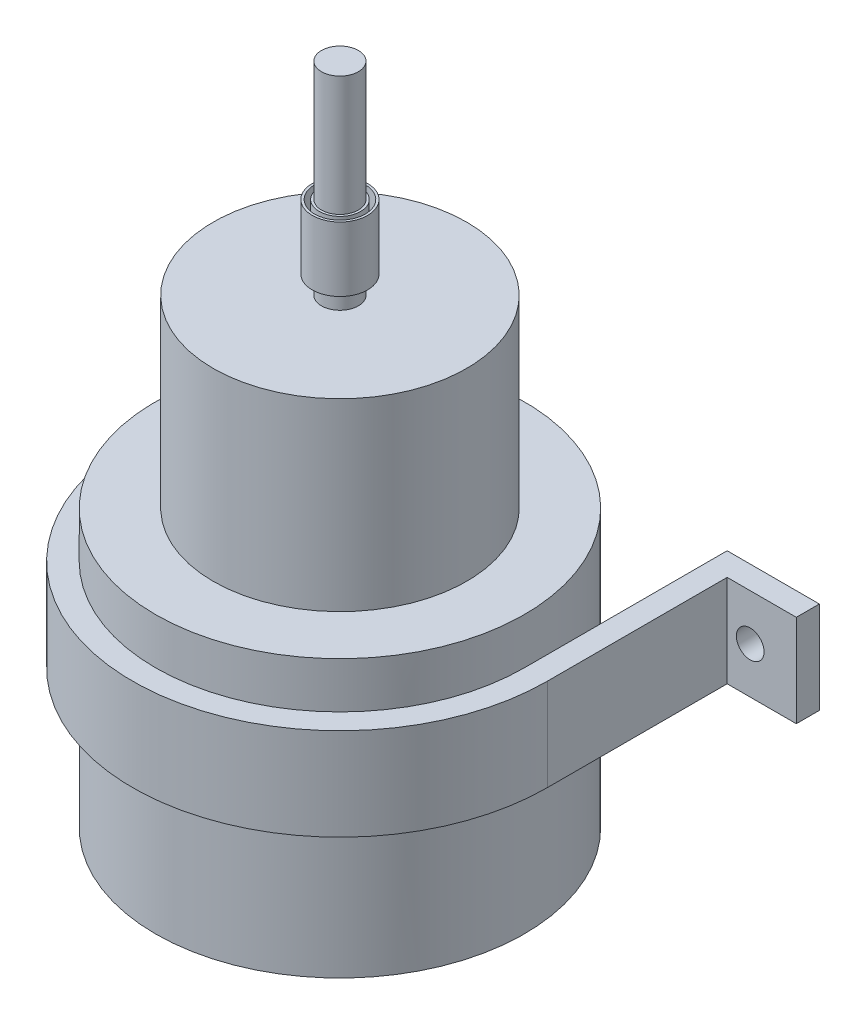
from build123d import *

# Parameters (mm, degrees)
SKETCH1_R           = 20
BOSS_EXTRUDE1_DEPTH = 30
SKETCH2_R           = 13.75
BOSS_EXTRUDE2_DEPTH = 20
SKETCH3_R           = 2
BOSS_EXTRUDE3_DEPTH = 22
EXTRUDE_THIN2_START = -10
EXTRUDE_THIN2_DEPTH = 10
SKETCH6_R           = 1.5
CUT_EXTRUDE1_DEPTH  = 10
SKETCH7_R           = 3
SKETCH7_R_2         = 2.75
SKETCH7_R_3         = 2.25
SKETCH7_R_4         = 2
BOSS_EXTRUDE4_DEPTH = 7


with BuildPart() as part:
    # Sketch1 → Boss-Extrude1 (new body)
    with BuildSketch(Plane(origin=(0, 0, 0), x_dir=(1, 0, 0), z_dir=(0, 1, 0))):
        with Locations(Location((0, 0, 0), (0, 0, 270))):
            Circle(SKETCH1_R)
    extrude(amount=BOSS_EXTRUDE1_DEPTH)

    # Sketch2 → Boss-Extrude2 (add)
    with BuildSketch(Plane(origin=(0, 30, 0), x_dir=(1, 0, 0), z_dir=(0, 1, 0))):
        with Locations(Location((0, 0, 0), (0, 0, 270))):
            Circle(SKETCH2_R)
    extrude(amount=BOSS_EXTRUDE2_DEPTH)

    # Sketch3 → Boss-Extrude3 (add)
    with BuildSketch(Plane(origin=(0, 50, 0), x_dir=(1, 0, 0), z_dir=(0, 1, 0))):
        with Locations(Location((0, 0, 0), (0, 0, 270))):
            Circle(SKETCH3_R)
    extrude(amount=BOSS_EXTRUDE3_DEPTH)

    # Sketch4 → Extrude-Thin2 (add)
    with BuildSketch(Plane(origin=(0, 25, 0), x_dir=(1, 0, 0), z_dir=(0, 1, 0)).offset(EXTRUDE_THIN2_START)):
        with BuildLine():
            Line((30, 22), (20, 22))
            Line((20, 22), (20, 0))
            ThreePointArc((20, 0), (0, -20), (-20, 0))
            Line((-20, 0), (-20, 22))
            Line((-20, 22), (-30, 22))
            Line((-30, 22), (-30, 19.5))
            Line((-30, 19.5), (-22.5, 19.5))
            Line((-22.5, 19.5), (-22.5, 0))
            ThreePointArc((-22.5, 0), (0, -22.5), (22.5, 0))
            Line((22.5, 0), (22.5, 19.5))
            Line((22.5, 19.5), (30, 19.5))
            Line((30, 19.5), (30, 22))
        make_face()
    extrude(amount=EXTRUDE_THIN2_DEPTH)

    # Sketch6 → Cut-Extrude1 (cut)
    with BuildSketch(Plane(origin=(0, 0, -22), x_dir=(-1, 0, 0), z_dir=(0, 0, -1))):
        with Locations((-25, 20)):
            Circle(SKETCH6_R)
        with Locations(Location((25, 20, 0), (0, 0, 180))):
            Circle(SKETCH6_R)
    extrude(amount=-CUT_EXTRUDE1_DEPTH, mode=Mode.SUBTRACT)

    # Sketch7 → Boss-Extrude4 (add)
    # profile 1 of 2: a face of its own
    with BuildSketch(Plane(origin=(0, 52, 0), x_dir=(1, 0, 0), z_dir=(0, 1, 0))):
        with Locations(Location((0, 0, 0), (0, 0, 90))):
            Circle(SKETCH7_R)
        with Locations(Location((0, 0, 0), (0, 0, 90))):
            Circle(SKETCH7_R_2, mode=Mode.SUBTRACT)
    # profile 2 of 2: a face of its own
    with BuildSketch(Plane(origin=(0, 52, 0), x_dir=(1, 0, 0), z_dir=(0, 1, 0))):
        with Locations(Location((0, 0, 0), (0, 0, 90))):
            Circle(SKETCH7_R_3)
        with Locations(Location((0, 0, 0), (0, 0, 270))):
            Circle(SKETCH7_R_4, mode=Mode.SUBTRACT)
    extrude(amount=BOSS_EXTRUDE4_DEPTH)


with BuildPart() as boss_extrude4_piece_1:
    # of the separate pieces the step leaves, piece 1, a body of its own (boss_extrude4_pieces)
    add(part.part.solids().sort_by_distance((0, 0, 20))[0])


with BuildPart() as boss_extrude4_piece_2:
    # of the separate pieces the step leaves, piece 2, a body of its own (boss_extrude4_pieces)
    add(part.part.solids().sort_by_distance((0, 52, -3))[0])


solid = Compound([boss_extrude4_piece_1.part, boss_extrude4_piece_2.part])
